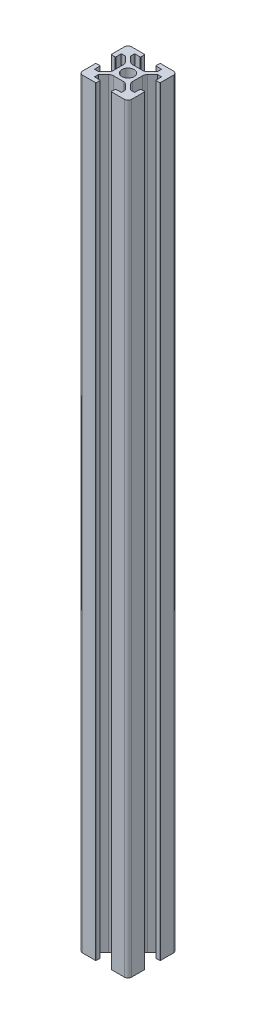
from build123d import *
from build123d.topology import SkipClean

# Parameters (mm, degrees)
BOSS_EXTRUDE1_DEPTH = 310
FILLET1_R           = 1.5
FILLET2_R           = 0.2
FILLET3_R           = 2
SKETCH2_R           = 2.1
CUT_EXTRUDE1_DEPTH  = 312.287648325


with BuildPart() as part:
    # Sketch1 → Boss-Extrude1 (new body)
    with BuildSketch(Plane(origin=(0, 0, 0), x_dir=(1, 0, 0), z_dir=(0, 1, 0))):
        Polygon((0, 20), (0, 13.1), (1.8, 13.1), (1.8, 15.5), (1.8, 17.139339828), (1.8, 18.2), (2.860660172, 18.2), (4.5, 18.2), (6.9, 18.2), (6.9, 20), align=None)
        Polygon((1.8, 18.2), (1.8, 17.139339828), (3.439339828, 15.5), (4.5, 15.5), (4.5, 16.560660172), (2.860660172, 18.2), align=None)
        Polygon((4.5, 16.560660172), (4.5, 18.2), (2.860660172, 18.2), align=None)
        Polygon((1.8, 17.139339828), (1.8, 15.5), (3.439339828, 15.5), align=None)
        Polygon((4.5, 15.5), (3.439339828, 15.5), (6.1, 12.839339828), (6.1, 13.9), (7.160660172, 13.9), (4.5, 16.560660172), align=None)
        Polygon((18.2, 13.1), (20, 13.1), (20, 20), (13.1, 20), (13.1, 18.2), (15.5, 18.2), (17.139339828, 18.2), (18.2, 18.2), (18.2, 17.139339828), (18.2, 15.5), align=None)
        Polygon((17.139339828, 18.2), (15.5, 18.2), (15.5, 16.560660172), align=None)
        Polygon((16.560660172, 15.5), (18.2, 17.139339828), (18.2, 18.2), (17.139339828, 18.2), (15.5, 16.560660172), (15.5, 15.5), align=None)
        Polygon((16.560660172, 15.5), (18.2, 15.5), (18.2, 17.139339828), align=None)
        Polygon((13.9, 12.839339828), (16.560660172, 15.5), (15.5, 15.5), (15.5, 16.560660172), (12.839339828, 13.9), (13.9, 13.9), align=None)
        with BuildLine():
            Line((12.839339828, 13.9), (7.160660172, 13.9))
            Line((7.160660172, 13.9), (8.84398789, 12.216672281))
            ThreePointArc((8.84398789, 12.216672281), (10, 12.5), (11.15601211, 12.216672281))
            Line((11.15601211, 12.216672281), (12.839339828, 13.9))
        make_face()
        with BuildLine():
            Line((6.1, 13.9), (6.1, 12.839339828))
            Line((6.1, 12.839339828), (7.783327719, 11.15601211))
            ThreePointArc((7.783327719, 11.15601211), (8.232233047, 11.767766953), (8.84398789, 12.216672281))
            Line((8.84398789, 12.216672281), (7.160660172, 13.9))
            Line((7.160660172, 13.9), (6.1, 13.9))
        make_face()
        with BuildLine():
            Line((12.216672281, 11.15601211), (13.9, 12.839339828))
            Line((13.9, 12.839339828), (13.9, 13.9))
            Line((13.9, 13.9), (12.839339828, 13.9))
            Line((12.839339828, 13.9), (11.15601211, 12.216672281))
            ThreePointArc((11.15601211, 12.216672281), (11.767766953, 11.767766953), (12.216672281, 11.15601211))
        make_face()
        with BuildLine():
            Line((12.216672281, 8.84398789), (13.9, 7.160660172))
            Line((13.9, 7.160660172), (13.9, 12.839339828))
            Line((13.9, 12.839339828), (12.216672281, 11.15601211))
            ThreePointArc((12.216672281, 11.15601211), (12.428135159, 10.595113139), (12.5, 10))
            ThreePointArc((12.5, 10), (12.428135159, 9.404886861), (12.216672281, 8.84398789))
        make_face()
        with BuildLine():
            Line((6.1, 12.839339828), (6.1, 7.160660172))
            Line((6.1, 7.160660172), (7.783327719, 8.84398789))
            ThreePointArc((7.783327719, 8.84398789), (7.5, 10), (7.783327719, 11.15601211))
            Line((7.783327719, 11.15601211), (6.1, 12.839339828))
        make_face()
        with BuildLine():
            Line((6.1, 6.1), (7.160660172, 6.1))
            Line((7.160660172, 6.1), (8.84398789, 7.783327719))
            ThreePointArc((8.84398789, 7.783327719), (8.232233047, 8.232233047), (7.783327719, 8.84398789))
            Line((7.783327719, 8.84398789), (6.1, 7.160660172))
            Line((6.1, 7.160660172), (6.1, 6.1))
        make_face()
        with BuildLine():
            Line((8.84398789, 7.783327719), (7.160660172, 6.1))
            Line((7.160660172, 6.1), (12.839339828, 6.1))
            Line((12.839339828, 6.1), (11.15601211, 7.783327719))
            ThreePointArc((11.15601211, 7.783327719), (10, 7.5), (8.84398789, 7.783327719))
        make_face()
        with BuildLine():
            Line((11.15601211, 7.783327719), (12.839339828, 6.1))
            Line((12.839339828, 6.1), (13.9, 6.1))
            Line((13.9, 6.1), (13.9, 7.160660172))
            Line((13.9, 7.160660172), (12.216672281, 8.84398789))
            ThreePointArc((12.216672281, 8.84398789), (11.767766953, 8.232233047), (11.15601211, 7.783327719))
        make_face()
        Polygon((4.5, 4.5), (4.5, 3.439339828), (7.160660172, 6.1), (6.1, 6.1), (6.1, 7.160660172), (3.439339828, 4.5), align=None)
        Polygon((12.839339828, 6.1), (15.5, 3.439339828), (15.5, 4.5), (16.560660172, 4.5), (13.9, 7.160660172), (13.9, 6.1), align=None)
        Polygon((3.439339828, 4.5), (1.8, 4.5), (1.8, 2.860660172), align=None)
        Polygon((1.8, 1.8), (2.860660172, 1.8), (4.5, 3.439339828), (4.5, 4.5), (3.439339828, 4.5), (1.8, 2.860660172), align=None)
        Polygon((2.860660172, 1.8), (4.5, 1.8), (4.5, 3.439339828), align=None)
        Polygon((0, 6.9), (0, 0), (6.9, 0), (6.9, 1.8), (4.5, 1.8), (2.860660172, 1.8), (1.8, 1.8), (1.8, 2.860660172), (1.8, 4.5), (1.8, 6.9), align=None)
        Polygon((18.2, 2.860660172), (18.2, 4.5), (16.560660172, 4.5), align=None)
        Polygon((15.5, 3.439339828), (17.139339828, 1.8), (18.2, 1.8), (18.2, 2.860660172), (16.560660172, 4.5), (15.5, 4.5), align=None)
        Polygon((15.5, 3.439339828), (15.5, 1.8), (17.139339828, 1.8), align=None)
        Polygon((13.1, 1.8), (13.1, 0), (20, 0), (20, 6.9), (18.2, 6.9), (18.2, 4.5), (18.2, 2.860660172), (18.2, 1.8), (17.139339828, 1.8), (15.5, 1.8), align=None)
    extrude(amount=BOSS_EXTRUDE1_DEPTH)

    # Fillet1
    fillet1_edges = [part.edges().sort_by_distance(p)[0] for p in [
        (0, 155, 0),
        (0, 155, -20),
        (20, 155, -20),
        (20, 155, 0),
    ]]
    fillet(fillet1_edges, radius=FILLET1_R)

    # Fillet2
    fillet2_edges = [part.edges().sort_by_distance(p)[0] for p in [
        (6.9, 155, -1.8),
        (6.9, 155, 0),
        (0, 155, -6.9),
        (1.8, 155, -6.9),
        (1.8, 155, -4.5),
        (3.439339828, 155, -4.5),
        (3.439339828, 155, -15.5),
        (1.8, 155, -15.5),
        (1.8, 155, -13.1),
        (0, 155, -13.1),
        (6.9, 155, -20),
        (6.9, 155, -18.2),
        (4.5, 155, -18.2),
        (4.5, 155, -16.560660172),
        (15.5, 155, -16.560660172),
        (15.5, 155, -18.2),
        (13.1, 155, -18.2),
        (13.1, 155, -20),
        (20, 155, -13.1),
        (18.2, 155, -13.1),
        (18.2, 155, -15.5),
        (16.560660172, 155, -15.5),
        (16.560660172, 155, -4.5),
        (18.2, 155, -4.5),
        (18.2, 155, -6.9),
        (20, 155, -6.9),
        (13.1, 155, 0),
        (13.1, 155, -1.8),
        (15.5, 155, -1.8),
        (15.5, 155, -3.439339828),
        (4.5, 155, -3.439339828),
        (4.5, 155, -1.8),
    ]]
    fillet(fillet2_edges, radius=FILLET2_R)

    # Fillet3
    fillet3_edges = [part.edges().sort_by_distance(p)[0] for p in [
        (6.1, 155, -7.160660172),
        (6.1, 155, -12.839339828),
        (7.160660172, 155, -13.9),
        (12.839339828, 155, -13.9),
        (13.9, 155, -12.839339828),
        (13.9, 155, -7.160660172),
        (12.839339828, 155, -6.1),
        (7.160660172, 155, -6.1),
    ]]
    fillet(fillet3_edges, radius=FILLET3_R)

    # Sketch2 → Cut-Extrude1 (cut, through all)
    with SkipClean():  # the faces are left unmerged after this step: merging them gives an invalid solid
        with BuildSketch(Plane(origin=(0, 0, -20), x_dir=(-1, 0, 0), z_dir=(0, 0, -1))):
            with Locations(Location((-10, 297, 0), (0, 0, 16.748783839))):
                Circle(SKETCH2_R)
            with Locations(Location((-10, 254, 0), (0, 0, 343.251216161))):
                Circle(SKETCH2_R)
            with Locations(Location((-10, 53, 0), (0, 0, 16.748783839))):
                Circle(SKETCH2_R)
            with Locations(Location((-10, 10, 0), (0, 0, 16.748783839))):
                Circle(SKETCH2_R)
        extrude(amount=-CUT_EXTRUDE1_DEPTH, mode=Mode.SUBTRACT)


solid = part.part
